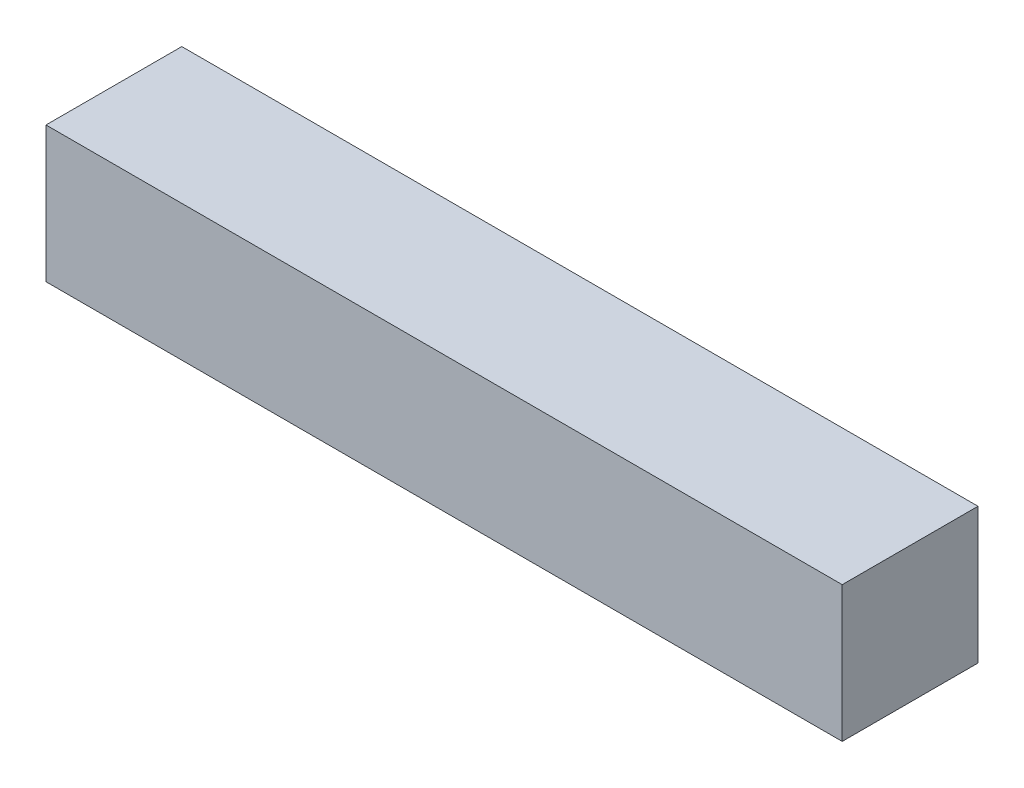
from build123d import *

# Parameters (mm, degrees)
SKETCH1_W           = 66
SKETCH1_H           = 66
BOSS_EXTRUDE1_DEPTH = 387


with BuildPart() as part:
    # Sketch1 → Boss-Extrude1 (new body)
    with BuildSketch(Plane(origin=(0, 0, 0), x_dir=(0, 0, -1), z_dir=(1, 0, 0))):
        Rectangle(SKETCH1_W, SKETCH1_H)
    extrude(amount=BOSS_EXTRUDE1_DEPTH)


solid = part.part
